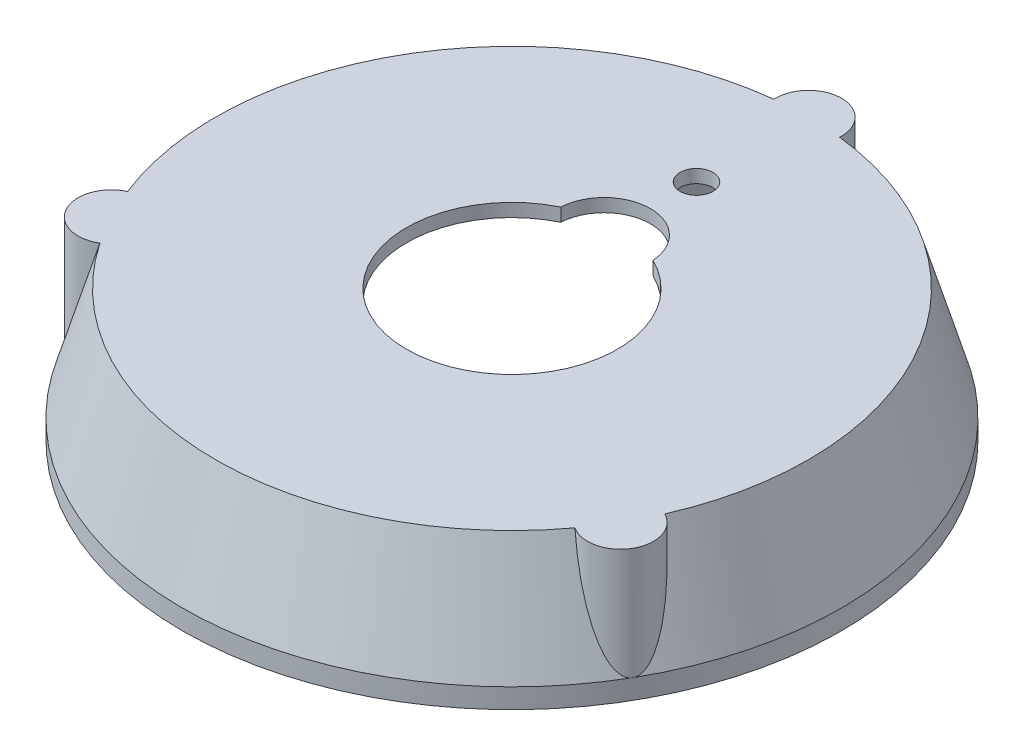
from build123d import *
from build123d.topology import SkipClean

# Parameters (mm, degrees)
SKIZZE1_R                       = 50
AUFSATZ_LINEAR_AUSTRAGEN1_DEPTH = 3
SKIZZE7_R                       = 5.030567549
SKIZZE7_R_2                     = 5
AUFSATZ_LINEAR_AUSTRAGEN4_DEPTH = 20
AUFSATZ_LINEAR_START            = -2
SKIZZE8_R                       = 45
AUFSATZ_LINEAR_AUSTRAGEN5_DEPTH = 2
SKIZZE9_R                       = 2.5
SCHNITT_LINEAR_AUSTRAGEN1_DEPTH = 2
SKIZZE10_R                      = 1.9
SCHNITT_LINEAR_AUSTRAGEN2_DEPTH = 18


with BuildPart() as part:
    # Skizze1 → Aufsatz-Linear austragen1 (new body)
    with BuildSketch(Plane(origin=(0, 0, 0), x_dir=(1, 0, 0), z_dir=(0, 1, 0))):
        with Locations(Location((0, 0, 0), (0, 0, 270))):
            Circle(SKIZZE1_R)
        with BuildLine():
            ThreePointArc((-4.992277988, 44.722222222), (0, 40), (4.992277988, 44.722222222))
            ThreePointArc((4.992277988, 44.722222222), (38.97114317, 22.5), (41.226719552, -18.037671551))
            ThreePointArc((41.226719552, -18.037671551), (34.641016151, -20), (36.234441564, -26.684550671))
            ThreePointArc((36.234441564, -26.684550671), (-0.858918242, -44.991802136), (-37.226514275, -25.282140632))
            ThreePointArc((-37.226514275, -25.282140632), (-35.37911937, -18.663277112), (-41.88512765, -16.451020689))
            ThreePointArc((-41.88512765, -16.451020689), (-38.534584491, 23.239746085), (-4.992277988, 44.722222222))
        make_face(mode=Mode.SUBTRACT)
    extrude(amount=AUFSATZ_LINEAR_AUSTRAGEN1_DEPTH)

    # Skizze4 → Rotation1 (revolve)
    with BuildSketch(Plane.XY, mode=Mode.PRIVATE) as rotation1_sk:
        Polygon((-45, 20), (-50, 3), (-45, 3), (-40, 20), align=None)
    revolve(rotation1_sk.sketch.rotate(Axis((0, 0, 0), (0, 1, 0)), 270), axis=Axis((0, 0, 0), (0, 1, 0)))

    # Skizze7 → Aufsatz-Linear austragen4 (add)
    with SkipClean():  # the faces are left unmerged after this step: merging them gives an invalid solid
        with BuildSketch(Plane.XZ):
            with Locations((-39.801509292, 20.996186751)):
                Circle(SKIZZE7_R)
            with Locations((0, -45)):
                Circle(SKIZZE7_R_2)
            with Locations((38.97114317, 22.5)):
                Circle(SKIZZE7_R_2)
        extrude(amount=-AUFSATZ_LINEAR_AUSTRAGEN4_DEPTH)

    # Skizze8 → Aufsatz-Linear austragen5 (add)
    with BuildSketch(Plane(origin=(0, 20, 0), x_dir=(1, 0, 0), z_dir=(0, 1, 0)).offset(AUFSATZ_LINEAR_START)):
        Circle(SKIZZE8_R)
    extrude(amount=AUFSATZ_LINEAR_AUSTRAGEN5_DEPTH)

    # Skizze9 → Schnitt-Linear austragen1 (cut)
    with BuildSketch(Plane(origin=(0, 20, 0), x_dir=(1, 0, 0), z_dir=(0, 1, 0))):
        with BuildLine():
            ThreePointArc((-1.885847319, 20.741185347), (-5.455813521, 18.385669713), (-6.988967253, 14.392857143))
            ThreePointArc((-6.988967253, 14.392857143), (0, -16), (6.988967253, 14.392857143))
            ThreePointArc((6.988967253, 14.392857143), (4.072563813, 19.693349101), (-1.885847319, 20.741185347))
        make_face()
        with Locations(Location((0, 28, 0), (0, 0, 270))):
            Circle(SKIZZE9_R)
    extrude(amount=-SCHNITT_LINEAR_AUSTRAGEN1_DEPTH, mode=Mode.SUBTRACT)

    # Skizze10 → Schnitt-Linear austragen2 (cut)
    with BuildSketch(Plane.XZ):
        with Locations(Location((-39.801509292, 20.996186751, 0), (0, 0, 270))):
            Circle(SKIZZE10_R)
        with Locations(Location((38.97114317, 22.5, 0), (0, 0, 270))):
            Circle(SKIZZE10_R)
        with Locations(Location((0, -45, 0), (0, 0, 270))):
            Circle(SKIZZE10_R)
    extrude(amount=-SCHNITT_LINEAR_AUSTRAGEN2_DEPTH, mode=Mode.SUBTRACT)


solid = part.part
